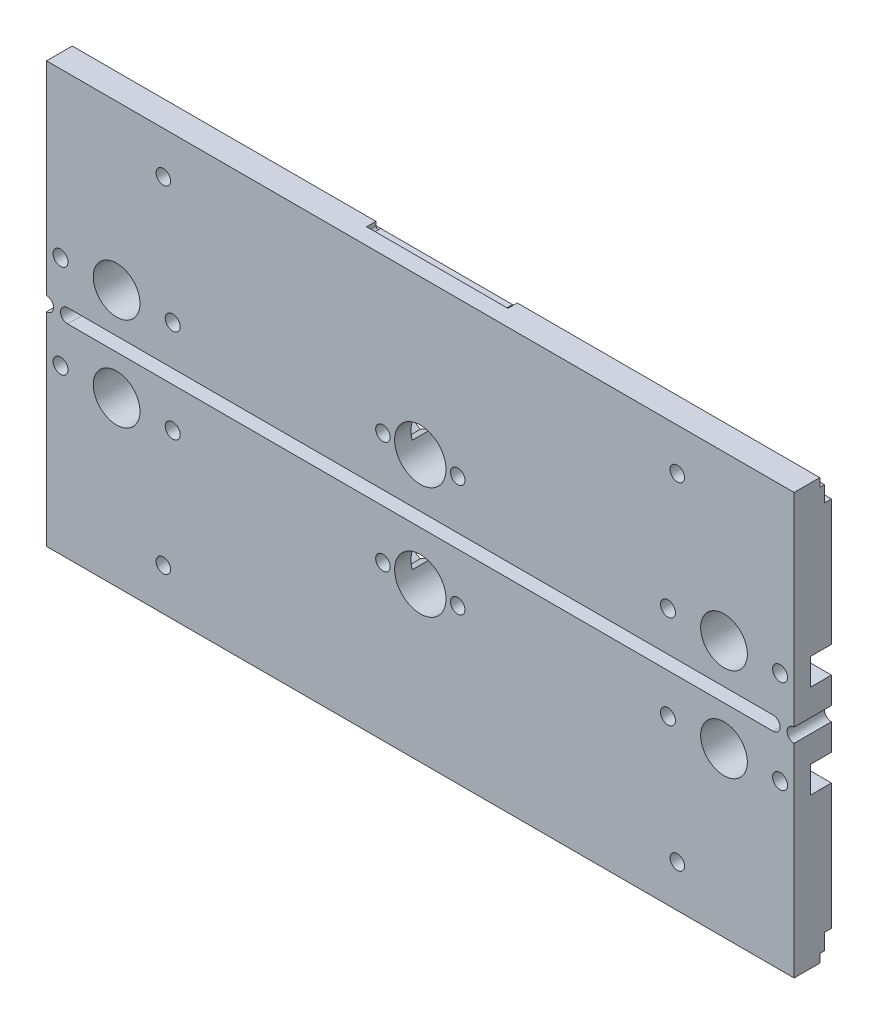
from build123d import *

# Parameters (mm, degrees)
SKETCH_2_W           = 160
SKETCH_2_H           = 43.5
SKETCH_2_R           = 5
SKETCH_2_R_2         = 4.05
EXTRUDE_1_DEPTH      = 8
CUT_EXTRUDE_2_DEPTH  = 167.00075301
SKETCH_5_R           = 1.55
CUT_EXTRUDE_3_DEPTH  = 167.00075301
SKETCH_20_R          = 5.5
CUT_EXTRUDE_17_DEPTH = 167.00075301
SKETCH_29_R          = 1.6
CUT_EXTRUDE_18_DEPTH = 167.00075301
CUT_EXTRUDE_START    = -4.5
SKETCH_8_R           = 1.6
CUT_EXTRUDE_5_DEPTH  = 4.5
SKETCH_25_R          = 1.55
CUT_EXTRUDE_13_DEPTH = 167.00075301
CUT_EXTRUDE_11_DEPTH = 2
EXTRUDE_2_DEPTH      = 8


with BuildPart() as part:
    # 草图2 → 凸台-拉伸1 (new body)
    with BuildSketch(Plane.XY):
        with Locations((80, 21.75)):
            Rectangle(SKETCH_2_W, SKETCH_2_H)
        with Locations((15, 8.5)):
            Circle(SKETCH_2_R, mode=Mode.SUBTRACT)
        with Locations((80, 10.5)):
            Circle(SKETCH_2_R_2, mode=Mode.SUBTRACT)
        with Locations((145, 8.5)):
            Circle(SKETCH_2_R, mode=Mode.SUBTRACT)
    extrude_1 = extrude(amount=EXTRUDE_1_DEPTH)

    # 草图4 → 切除-拉伸2 (cut, through all)
    with BuildSketch(Plane(origin=(160, 0, 0), x_dir=(0, 0, -1), z_dir=(1, 0, 0))):
        Polygon((-1.5, 41.7), (-2.5, 41.7), (-2.5, 43.5), (0, 43.5), (0, 38.3), (-1.5, 38.3), align=None)
    cut_extrude_2 = extrude(amount=-CUT_EXTRUDE_2_DEPTH, mode=Mode.SUBTRACT)

    # 草图5 → 切除-拉伸3 (cut, through all)
    with BuildSketch(Plane.XY.offset(8)):
        with Locations((88, 10.5)):
            Circle(SKETCH_5_R)
        with Locations((72, 10.5)):
            Circle(SKETCH_5_R)
    cut_extrude_3 = extrude(amount=-CUT_EXTRUDE_3_DEPTH, mode=Mode.SUBTRACT)

    # 草图20 → 切除-拉伸17 (cut, through all)
    with BuildSketch(Plane(origin=(0, 0, 0), x_dir=(-1, 0, 0), z_dir=(0, 0, -1))):
        with Locations((-80, 10.5)):
            Circle(SKETCH_20_R)
    cut_extrude_17 = extrude(amount=-CUT_EXTRUDE_17_DEPTH, mode=Mode.SUBTRACT)

    # 草图29 → 切除-拉伸18 (cut, through all)
    with BuildSketch(Plane.XY.offset(8)):
        with Locations((27, 8.5)):
            Circle(SKETCH_29_R)
        with Locations((133, 8.5)):
            Circle(SKETCH_29_R)
        with Locations((3, 8.5)):
            Circle(SKETCH_29_R)
        with Locations((157, 8.5)):
            Circle(SKETCH_29_R)
    cut_extrude_18 = extrude(amount=-CUT_EXTRUDE_18_DEPTH, mode=Mode.SUBTRACT)

    # 草图8 → 切除-拉伸5 (cut)
    # profile 1 of 6: a face of its own
    with BuildSketch(Plane(origin=(0, 0, 0), x_dir=(-1, 0, 0), z_dir=(0, 0, -1)).offset(CUT_EXTRUDE_START)):
        Polygon((0, 11.35), (-4.645448267, 11.35), (-6.290896534, 8.5), (-4.645448267, 5.65), (0, 5.65), align=None)
        with Locations((-3, 8.5)):
            Circle(SKETCH_8_R, mode=Mode.SUBTRACT)
    # profile 2 of 6: a face of its own
    with BuildSketch(Plane(origin=(0, 0, 0), x_dir=(-1, 0, 0), z_dir=(0, 0, -1)).offset(CUT_EXTRUDE_START)):
        Polygon((-88, 7.209103466), (-85.15, 8.854551733), (-85.15, 12.145448267), (-88, 13.790896534), (-90.85, 12.145448267), (-90.85, 8.854551733), align=None)
    # profile 3 of 6: a face of its own
    with BuildSketch(Plane(origin=(0, 0, 0), x_dir=(-1, 0, 0), z_dir=(0, 0, -1)).offset(CUT_EXTRUDE_START)):
        Polygon((-72, 7.209103466), (-69.15, 8.854551733), (-69.15, 12.145448267), (-72, 13.790896534), (-74.85, 12.145448267), (-74.85, 8.854551733), align=None)
    # profile 4 of 6: a face of its own
    with BuildSketch(Plane(origin=(0, 0, 0), x_dir=(-1, 0, 0), z_dir=(0, 0, -1)).offset(CUT_EXTRUDE_START)):
        Polygon((-29.85, 6.854551733), (-27, 5.209103466), (-24.15, 6.854551733), (-24.15, 10.145448267), (-27, 11.790896534), (-29.85, 10.145448267), align=None)
    # profile 5 of 6: a face of its own
    with BuildSketch(Plane(origin=(0, 0, 0), x_dir=(-1, 0, 0), z_dir=(0, 0, -1)).offset(CUT_EXTRUDE_START)):
        Polygon((-133, 5.209103466), (-130.15, 6.854551733), (-130.15, 10.145448267), (-133, 11.790896534), (-135.85, 10.145448267), (-135.85, 6.854551733), align=None)
    # profile 6 of 6: a face of its own
    with BuildSketch(Plane(origin=(0, 0, 0), x_dir=(-1, 0, 0), z_dir=(0, 0, -1)).offset(CUT_EXTRUDE_START)):
        Polygon((-155.354551733, 5.65), (-153.709103466, 8.5), (-155.354551733, 11.35), (-160, 11.35), (-160, 5.65), align=None)
        with Locations((-157, 8.5)):
            Circle(SKETCH_8_R, mode=Mode.SUBTRACT)
    cut_extrude_5 = extrude(amount=CUT_EXTRUDE_5_DEPTH, mode=Mode.SUBTRACT)

    # 草图25 → 切除-拉伸13 (cut, through all)
    with BuildSketch(Plane(origin=(0, 0, 0), x_dir=(-1, 0, 0), z_dir=(0, 0, -1))):
        with Locations((-135, 34.5)):
            Circle(SKETCH_25_R)
        with Locations((-25, 34.5)):
            Circle(SKETCH_25_R)
    cut_extrude_13 = extrude(amount=-CUT_EXTRUDE_13_DEPTH, mode=Mode.SUBTRACT)

    # 草图19 → 切除-拉伸11 (cut)
    with BuildSketch(Plane(origin=(0, 0, 2.5), x_dir=(-1, 0, 0), z_dir=(0, 0, -1))):
        with BuildLine():
            Line((-65, 43.5), (-95.247938178, 43.5))
            Line((-95.247938178, 43.5), (-95.247938178, 42.7))
            ThreePointArc((-95.247938178, 42.7), (-94.747938178, 42.2), (-94.247938178, 42.7))
            Line((-94.247938178, 42.7), (-66, 42.7))
            ThreePointArc((-66, 42.7), (-65.5, 42.2), (-65, 42.7))
            Line((-65, 42.7), (-65, 43.5))
        make_face()
    cut_extrude_11 = extrude(amount=-CUT_EXTRUDE_11_DEPTH, mode=Mode.SUBTRACT)

    # 草图22 → 凸台-拉伸2 (add)
    with BuildSketch(Plane.XY.offset(8)):
        with BuildLine():
            Line((0, -3), (4.5, -3))
            ThreePointArc((4.5, -3), (3, -1.5), (4.5, 0))
            Line((4.5, 0), (0, 0))
            ThreePointArc((0, 0), (1.5, -1.5), (0, -3))
        make_face()
        with BuildLine():
            Line((160, 0), (155.5, 0))
            ThreePointArc((155.5, 0), (157, -1.5), (155.5, -3))
            Line((155.5, -3), (160, -3))
            ThreePointArc((160, -3), (158.5, -1.5), (160, 0))
        make_face()
    extrude(amount=-EXTRUDE_2_DEPTH)

    # 镜向2: 凸台-拉伸1, 切除-拉伸2, 切除-拉伸3, 切除-拉伸17, 切除-拉伸18, 切除-拉伸5, 切除-拉伸13, 切除-拉伸11 across plane
    add(extrude_1.mirror(Plane(origin=(0, -1.5, 0), x_dir=(0, 0, 1), z_dir=(0, -1, 0))))
    add(cut_extrude_2.mirror(Plane(origin=(0, -1.5, 0), x_dir=(0, 0, 1), z_dir=(0, -1, 0))), mode=Mode.SUBTRACT)
    add(cut_extrude_3.mirror(Plane(origin=(0, -1.5, 0), x_dir=(0, 0, 1), z_dir=(0, -1, 0))), mode=Mode.SUBTRACT)
    add(cut_extrude_17.mirror(Plane(origin=(0, -1.5, 0), x_dir=(0, 0, 1), z_dir=(0, -1, 0))), mode=Mode.SUBTRACT)
    add(cut_extrude_18.mirror(Plane(origin=(0, -1.5, 0), x_dir=(0, 0, 1), z_dir=(0, -1, 0))), mode=Mode.SUBTRACT)
    add(cut_extrude_5.mirror(Plane(origin=(0, -1.5, 0), x_dir=(0, 0, 1), z_dir=(0, -1, 0))), mode=Mode.SUBTRACT)
    add(cut_extrude_13.mirror(Plane(origin=(0, -1.5, 0), x_dir=(0, 0, 1), z_dir=(0, -1, 0))), mode=Mode.SUBTRACT)
    add(cut_extrude_11.mirror(Plane(origin=(0, -1.5, 0), x_dir=(0, 0, 1), z_dir=(0, -1, 0))), mode=Mode.SUBTRACT)


solid = part.part
